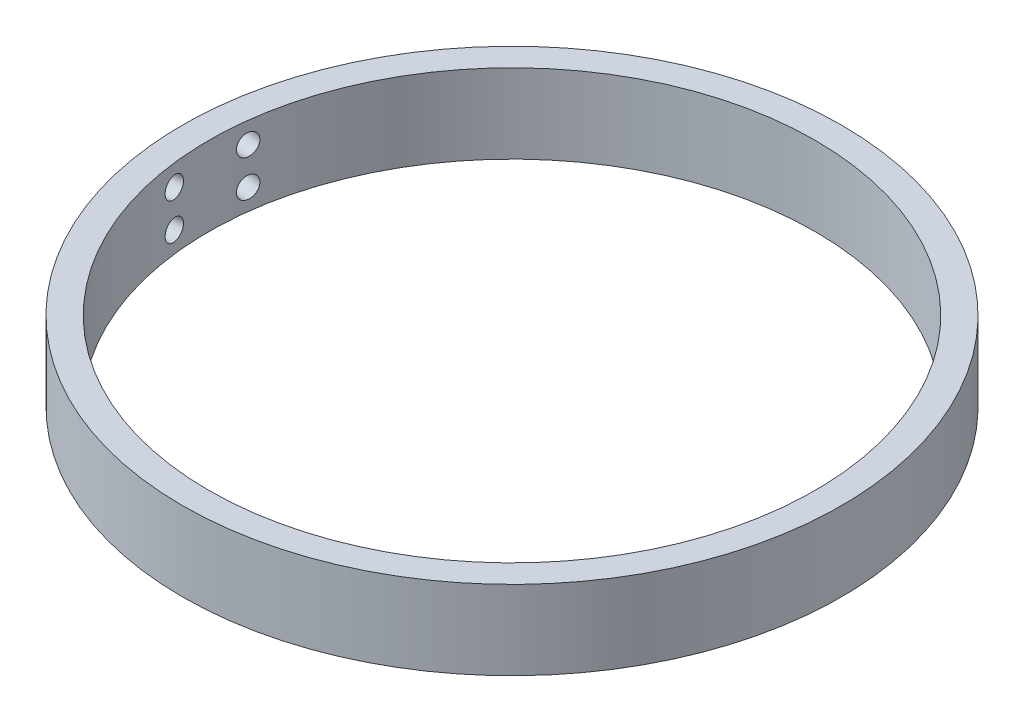
from build123d import *

# Parameters (mm, degrees)
SKETCH_1_R          = 62.5
SKETCH_1_R_2        = 57.5
EXTRUDE_1_DEPTH     = 15
SKETCH_3_R          = 2
CUT_EXTRUDE_1_DEPTH = 71
SKETCH_4_R          = 2
CUT_EXTRUDE_2_DEPTH = 71


with BuildPart() as part:
    # 草图1 → 凸台-拉伸1 (new body)
    with BuildSketch(Plane(origin=(0, 0, 0), x_dir=(1, 0, 0), z_dir=(0, 1, 0))):
        with Locations(Location((0, 0, 0), (0, 0, 270))):
            Circle(SKETCH_1_R)
        with Locations(Location((0, 0, 0), (0, 0, 270))):
            Circle(SKETCH_1_R_2, mode=Mode.SUBTRACT)
    extrude(amount=EXTRUDE_1_DEPTH)

    # 草图3 → 切除-拉伸1 (cut)
    with BuildSketch(Plane(origin=(0, 0, 0), x_dir=(-0.12186934340515121, 0, -0.9925461516413215), z_dir=(0.9925461516413215, 0, -0.12186934340515121))):
        with Locations((0, 11)):
            Circle(SKETCH_3_R)
        with Locations((0, 4)):
            Circle(SKETCH_3_R)
    extrude(amount=-CUT_EXTRUDE_1_DEPTH, mode=Mode.SUBTRACT)

    # 草图4 → 切除-拉伸2 (cut)
    with BuildSketch(Plane(origin=(0, 0, 0), x_dir=(0.12186934340514427, 0, -0.9925461516413224), z_dir=(0.9925461516413224, 0, 0.12186934340514427))):
        with Locations((0, 11)):
            Circle(SKETCH_4_R)
        with Locations((0, 4)):
            Circle(SKETCH_4_R)
    extrude(amount=-CUT_EXTRUDE_2_DEPTH, mode=Mode.SUBTRACT)


solid = part.part
